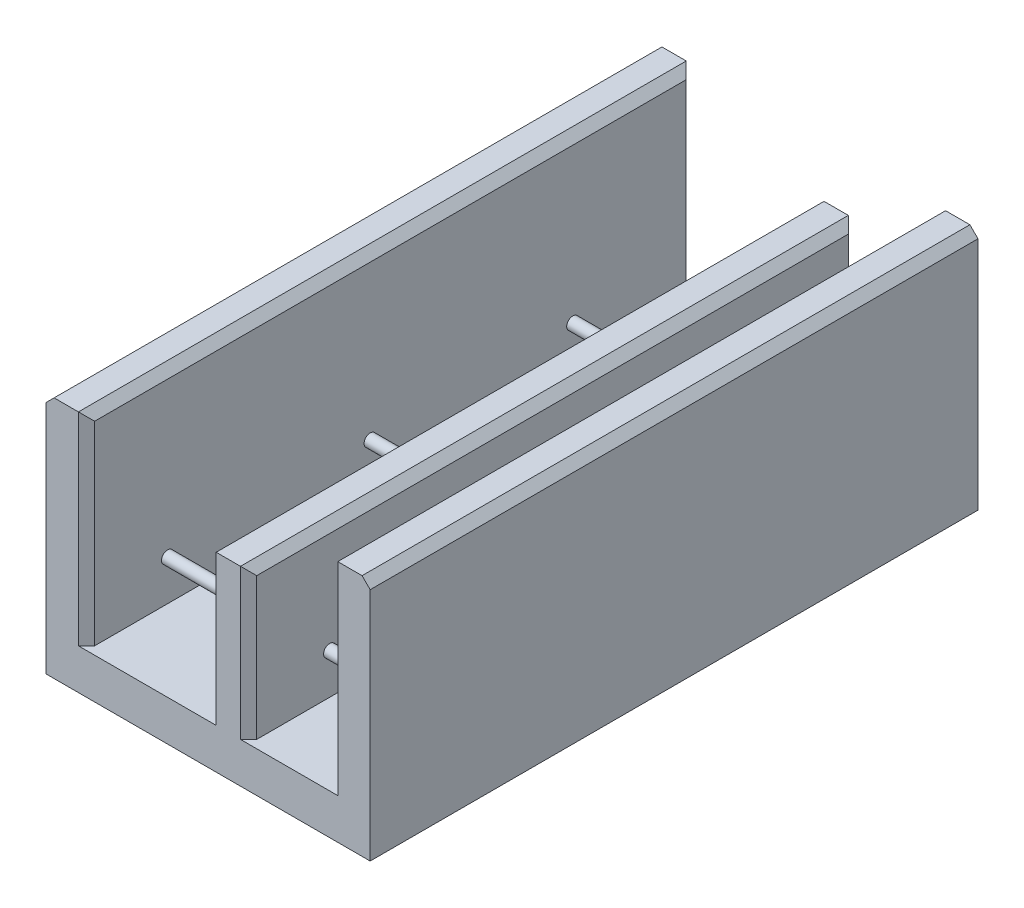
from build123d import *

# Parameters (mm, degrees)
SALIENTE_EXTRUIR1_DEPTH = 1500
CHAFL_N2_SIZE           = 20
SALIENTE_EXTRUIR2_REACH = 1804.776
CROQUIS2_R              = 15
MATRIZL1_COUNT          = 3
MATRIZL1_PITCH          = 500


with BuildPart() as part:
    # Croquis1 → Saliente-Extruir1 (new body)
    with BuildSketch(Plane.XY):
        Polygon((0, 0), (-800, 0), (-800, 600), (-700, 600), (-700, 100), (-400, 100), (-400, 470), (-300, 470), (-300, 100), (-100, 100), (-100, 600), (0, 600), align=None)
    extrude(amount=SALIENTE_EXTRUIR1_DEPTH)

    # Chaflán2
    chafl_n2_edges = [part.edges().sort_by_distance(p)[0] for p in [
        (-100, 350, 1500),
        (-700, 350, 0),
        (-400, 285, 0),
        (-300, 285, 0),
        (-100, 350, 0),
        (-300, 285, 1500),
        (-800, 600, 750),
        (-700, 600, 750),
        (-400, 470, 750),
        (-300, 470, 750),
        (-100, 600, 750),
        (0, 600, 750),
        (-400, 285, 1500),
        (-700, 350, 1500),
    ]]
    chamfer(chafl_n2_edges, length=CHAFL_N2_SIZE)

    # Saliente-Extruir2: up to this face of the body (flat: up to its plane)
    saliente_extruir2_end = Plane(part.part.faces().sort_by_distance((-100, 340, 750))[0])
    # Croquis2 → Saliente-Extruir2 (add, up to the picked face)
    with BuildSketch(Plane.ZY.offset(800), mode=Mode.PRIVATE) as saliente_extruir2_sk1:
        with Locations(Location((300, 200, 0), (0, 0, 270))):
            Circle(CROQUIS2_R)
    saliente_extruir2_tool1 = split(extrude(saliente_extruir2_sk1.sketch, amount=-SALIENTE_EXTRUIR2_REACH, mode=Mode.PRIVATE), bisect_by=saliente_extruir2_end, keep=Keep.BOTH, mode=Mode.PRIVATE)
    saliente_extruir2 = saliente_extruir2_tool1.solids().sort_by(Axis((-800, 200, 300), (1, 0, 0)))[0]
    add(saliente_extruir2)

    # MatrizL1: Saliente-Extruir2 ×3
    with Locations(*[(0, 0, i * MATRIZL1_PITCH) for i in range(1, MATRIZL1_COUNT)]):
        add(saliente_extruir2)


solid = part.part
